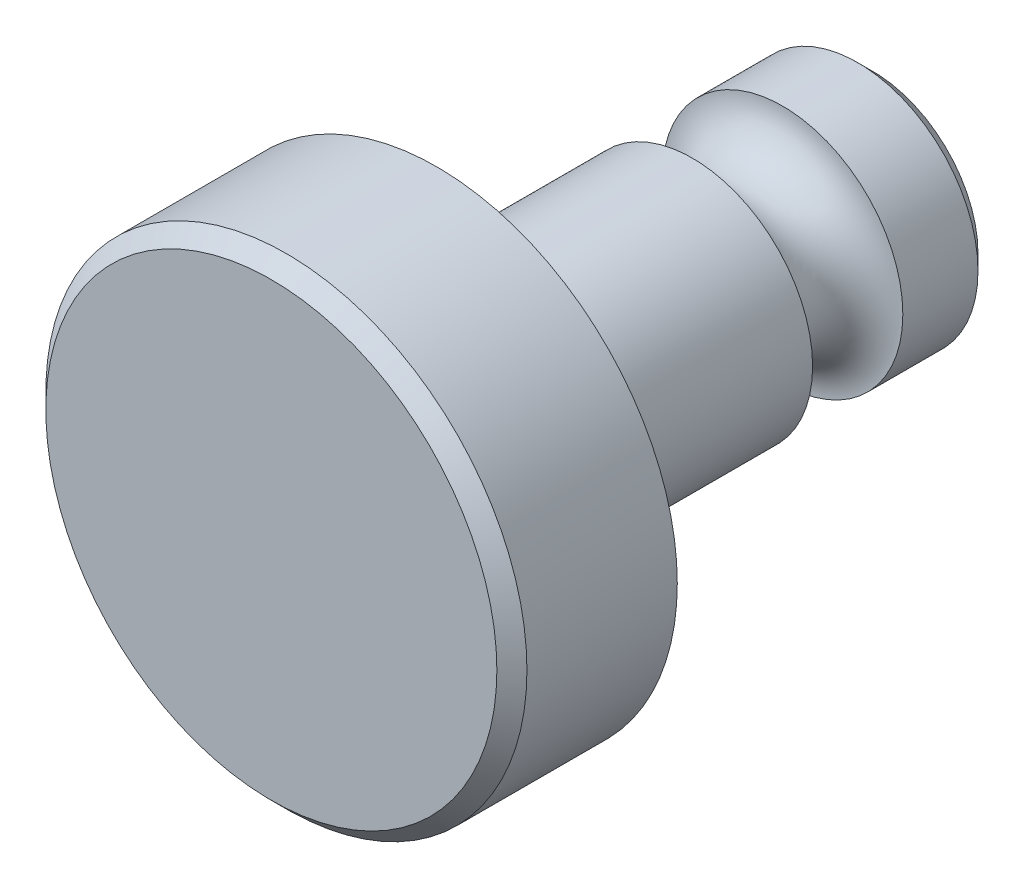
from build123d import *

# Parameters (mm, degrees)
SKETCH1_W     = 5.5
SKETCH1_H     = 8
CHAMFER1_SIZE = 0.5
CHAMFER2_SIZE = 0.5


with BuildPart() as part:
    # Sketch1 → Revolve1 (revolve)
    with BuildSketch(Plane(origin=(0, 0, 0), x_dir=(0, 0, -1), z_dir=(1, 0, 0)), mode=Mode.PRIVATE) as revolve1_sk:
        with Locations((2.75, 4)):
            Rectangle(SKETCH1_W, SKETCH1_H)
        with BuildLine():
            Line((5.5, 4), (5.5, 0))
            Line((5.5, 0), (20, 0))
            Line((20, 0), (20, 4))
            Line((20, 4), (17, 4))
            ThreePointArc((17, 4), (15.5, 2.5), (14, 4))
            Line((14, 4), (5.5, 4))
        make_face()
    revolve(revolve1_sk.sketch.rotate(Axis((0, 0, -5.5), (0, 0, -1)), 90), axis=Axis((0, 0, -5.5), (0, 0, -1)))

    # Chamfer1
    chamfer1_edges = [part.edges().sort_by_distance(p)[0] for p in [
        (-8, 0, 0),
    ]]
    chamfer(chamfer1_edges, length=CHAMFER1_SIZE)

    # Chamfer2
    chamfer2_edges = [part.edges().sort_by_distance(p)[0] for p in [
        (-4, 0, -20),
    ]]
    chamfer(chamfer2_edges, length=CHAMFER2_SIZE)


solid = part.part
